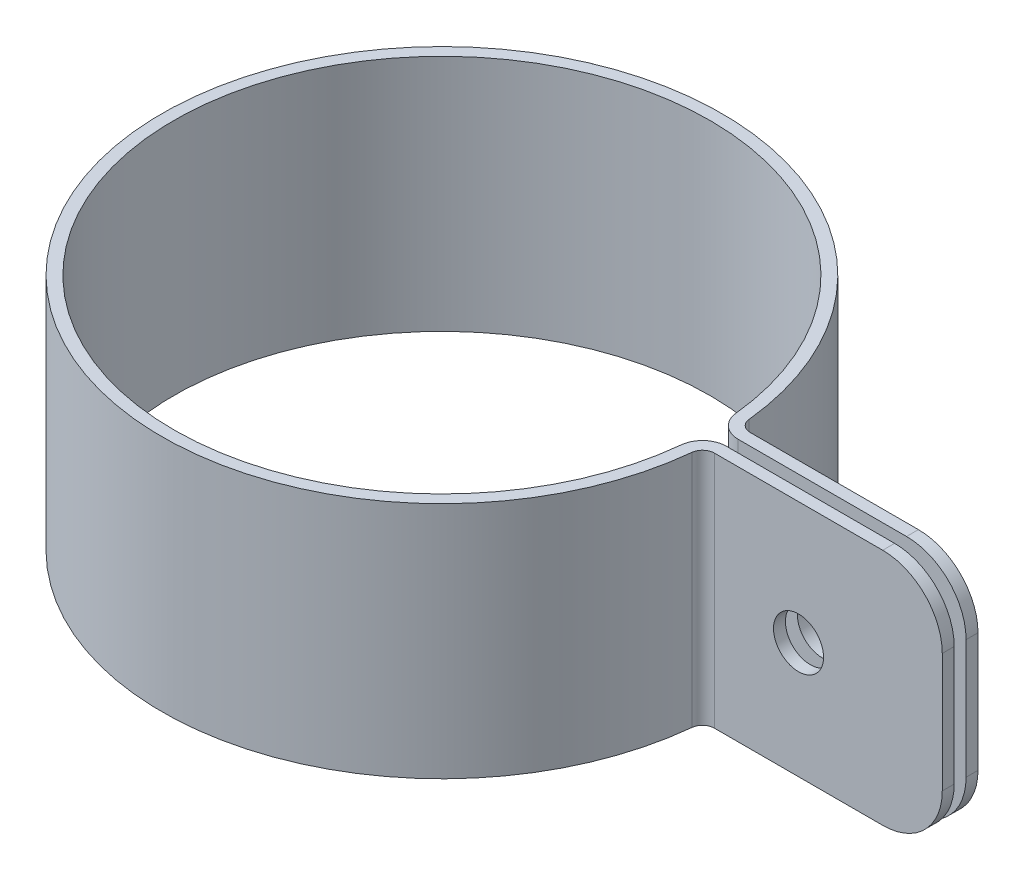
from build123d import *

# Parameters (mm, degrees)
EXTRUDE_1_DEPTH       = 20
FILLET_1_R            = 2
FILLET_2_R            = 1
FILLET_3_R            = 5
HOLE_WIZARD_M51_D     = 4.2
HOLE_WIZARD_M51_DEPTH = 38.5
HOLE_WIZARD_M51_TIP   = 1.2618073


with BuildPart() as part:
    # Эскиз1 → Бобышка-Вытянуть1 (new body)
    with BuildSketch(Plane(origin=(0, 0, 0), x_dir=(1, 0, 0), z_dir=(0, 1, 0))):
        with BuildLine():
            Line((43.5, -1.5), (23.452078799, -1.5))
            ThreePointArc((23.452078799, -1.5), (-23.5, 0), (23.452078799, 1.5))
            Line((23.452078799, 1.5), (43.5, 1.5))
            Line((43.5, 1.5), (43.5, 0.5))
            Line((43.5, 0.5), (22.494443758, 0.5))
            ThreePointArc((22.494443758, 0.5), (-22.5, 0), (22.494443758, -0.5))
            Line((22.494443758, -0.5), (43.5, -0.5))
            Line((43.5, -0.5), (43.5, -1.5))
        make_face()
    extrude(amount=EXTRUDE_1_DEPTH)

    # Скругление1
    fillet_1_edges = [part.edges().sort_by_distance(p)[0] for p in [
        (22.494443758, 10, -0.5),
        (22.494443758, 10, 0.5),
    ]]
    fillet(fillet_1_edges, radius=FILLET_1_R)

    # Скругление2
    fillet_2_edges = [part.edges().sort_by_distance(p)[0] for p in [
        (23.452078799, 10, 1.5),
        (23.452078799, 10, -1.5),
    ]]
    fillet(fillet_2_edges, radius=FILLET_2_R)

    # Скругление3
    fillet_3_edges = [part.edges().sort_by_distance(p)[0] for p in [
        (43.5, 0, -1),
        (43.5, 20, 1),
        (43.5, 20, -1),
        (43.5, 0, 1),
    ]]
    fillet(fillet_3_edges, radius=FILLET_3_R)

    # Отверстие обработанное метчиком M51
    with Locations(Plane(origin=(0, 0, -1.5), x_dir=(-1, 0, 0), z_dir=(0, 0, -1))):
        with Locations((-31.436057607, 9.737709053)):
            Hole(HOLE_WIZARD_M51_D / 2, depth=HOLE_WIZARD_M51_DEPTH)
            with Locations((0, 0, -(HOLE_WIZARD_M51_DEPTH + HOLE_WIZARD_M51_TIP / 2))):  # 118° drill point
                Cone(0, HOLE_WIZARD_M51_D / 2, HOLE_WIZARD_M51_TIP, mode=Mode.SUBTRACT)


solid = part.part
